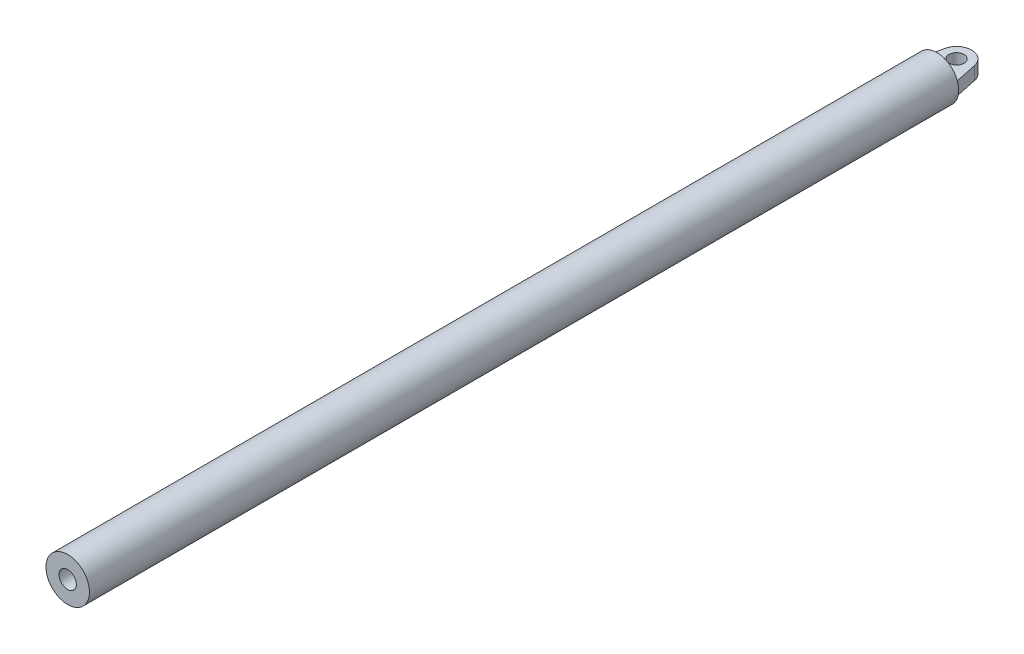
from build123d import *

# Parameters (mm, degrees)
SKETCH1_R           = 50
BOSS_EXTRUDE1_DEPTH = 2000
SHELL1_T            = -30
SKETCH2_R           = 17.5
BOSS_EXTRUDE2_DEPTH = 15


with BuildPart() as part:
    # Sketch1 → Boss-Extrude1 (new body)
    with BuildSketch(Plane.XY):
        Circle(SKETCH1_R)
    extrude(amount=BOSS_EXTRUDE1_DEPTH)

    # Shell1
    shell1_openings = [part.faces().sort_by_distance(p)[0] for p in [
        (0, 0, 2000),
    ]]
    offset(amount=SHELL1_T, openings=shell1_openings, kind=Kind.INTERSECTION)

    # Sketch2 → Boss-Extrude2 (add, symmetric)
    with BuildSketch(Plane(origin=(0, 0, 0), x_dir=(1, 0, 0), z_dir=(0, 1, 0))):
        with BuildLine():
            Line((-45, 0), (-34.28083908, 52.058616858))
            ThreePointArc((-34.28083908, 52.058616858), (0, 80), (34.28083908, 52.058616858))
            Line((34.28083908, 52.058616858), (45, 0))
            Line((45, 0), (-45, 0))
        make_face()
        with Locations(Location((0, 45, 0), (0, 0, 270))):
            Circle(SKETCH2_R, mode=Mode.SUBTRACT)
    extrude(amount=BOSS_EXTRUDE2_DEPTH, both=True)


solid = part.part
